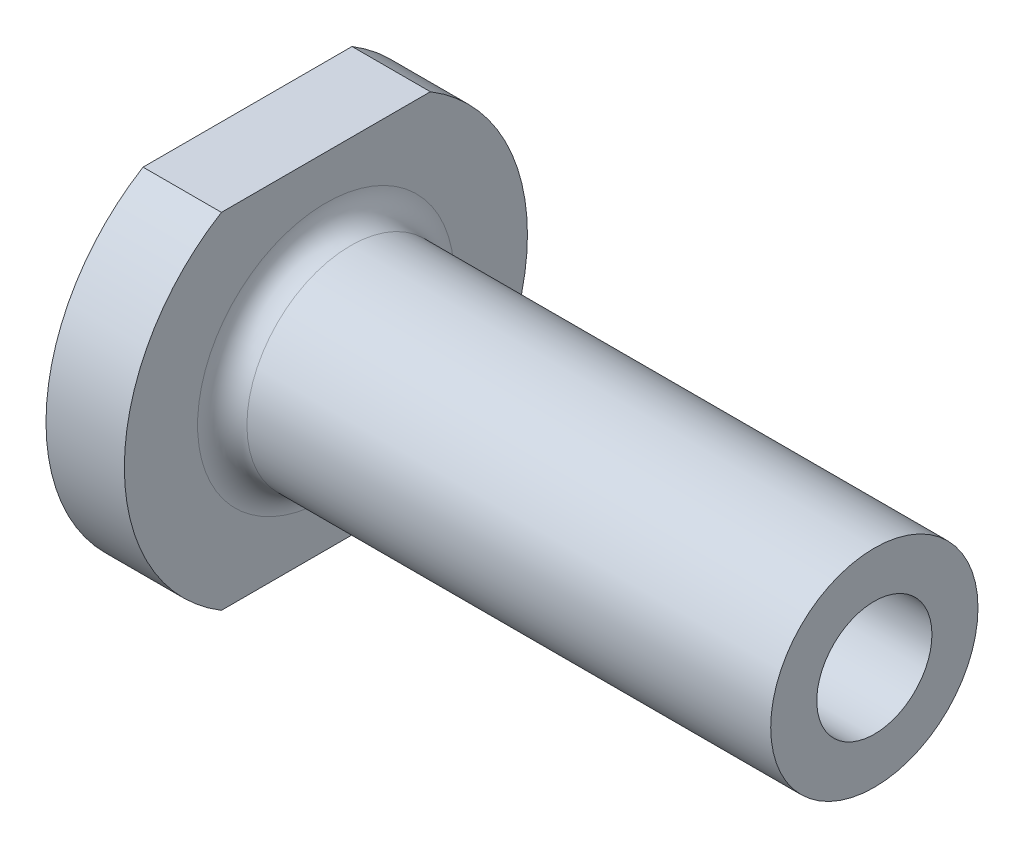
from build123d import *

# Parameters (mm, degrees)
FILLET1_R                            = 1.5
F_5_16_18_MAKE_SURE_TO_CHANGE_THIS_D = 7
CUT_EXTRUDE1_DEPTH                   = 42.853733412


with BuildPart() as part:
    # Sketch1 → Revolve1 (revolve)
    with BuildSketch(Plane.XY, mode=Mode.PRIVATE) as revolve1_sk:
        Polygon((0, 0), (38.1, 0), (38.1, 6.299999973), (4.7625, 6.299999973), (4.7625, 12.250000011), (0, 12.250000011), align=None)
    revolve(revolve1_sk.sketch.rotate(Axis((0, 0, 0), (-1, 0, 0)), 90), axis=Axis((0, 0, 0), (-1, 0, 0)))

    # Fillet1
    fillet1_edges = [part.edges().sort_by_distance(p)[0] for p in [
        (4.7625, 0, 6.299999973),
    ]]
    fillet(fillet1_edges, radius=FILLET1_R)

    # 5/16-18 MAKE SURE TO CHANGE THIS (through all)
    with Locations(Plane(origin=(38.1, 0, 0), x_dir=(0, 0, -1), z_dir=(1, 0, 0))):
        with Locations((0, 0)):
            Hole(F_5_16_18_MAKE_SURE_TO_CHANGE_THIS_D / 2)

    # Sketch4 → Cut-Extrude1 (cut, through all)
    with BuildSketch(Plane.ZY):
        with BuildLine():
            Line((-6.35, 10.475686148), (6.35, 10.475686148))
            ThreePointArc((6.35, 10.475686148), (0, 12.250000011), (-6.35, 10.475686148))
        make_face()
        with BuildLine():
            Line((6.35, -10.475686148), (-6.35, -10.475686148))
            ThreePointArc((-6.35, -10.475686148), (0, -12.250000011), (6.35, -10.475686148))
        make_face()
    extrude(amount=-CUT_EXTRUDE1_DEPTH, mode=Mode.SUBTRACT)


solid = part.part
